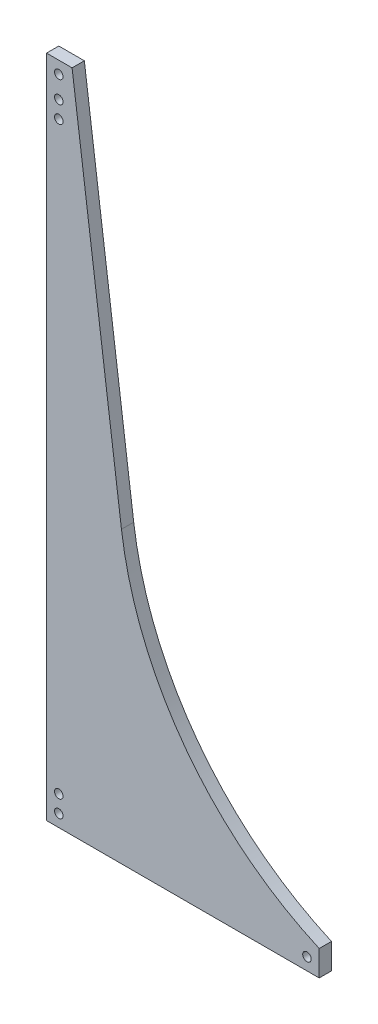
from build123d import *

# Parameters (mm, degrees)
BOSS_EXTRUDE1_DEPTH = 9.128125
SKETCH2_R           = 6.35
CUT_EXTRUDE1_DEPTH  = 1071.879363264


with BuildPart() as part:
    # Sketch1 → Boss-Extrude1 (new, symmetric)
    with BuildSketch(Plane.XY):
        with BuildLine():
            Line((0, 0), (406.4, 0))
            Line((406.4, 0), (406.4, 38.1))
            ThreePointArc((406.4, 38.1), (207.539140749, 196.40002074), (111.667415652, 431.8))
            Line((111.667415652, 431.8), (38.1, 990.6))
            Line((38.1, 990.6), (0, 990.6))
            Line((0, 990.6), (0, 0))
        make_face()
    extrude(amount=BOSS_EXTRUDE1_DEPTH, both=True)

    # Sketch2 → Cut-Extrude1 (cut, through all)
    with BuildSketch(Plane.XY.offset(9.128125)):
        with Locations((18.25625, 972.34375)):
            Circle(SKETCH2_R)
        with Locations((18.25625, 18.25625)):
            Circle(SKETCH2_R)
        with Locations((388.14375, 18.25625)):
            Circle(SKETCH2_R)
        with Locations((18.25625, 43.65625)):
            Circle(SKETCH2_R)
        with Locations((18.25625, 939.8)):
            Circle(SKETCH2_R)
        with Locations((18.25625, 914.4)):
            Circle(SKETCH2_R)
    extrude(amount=-CUT_EXTRUDE1_DEPTH, mode=Mode.SUBTRACT)


solid = part.part
